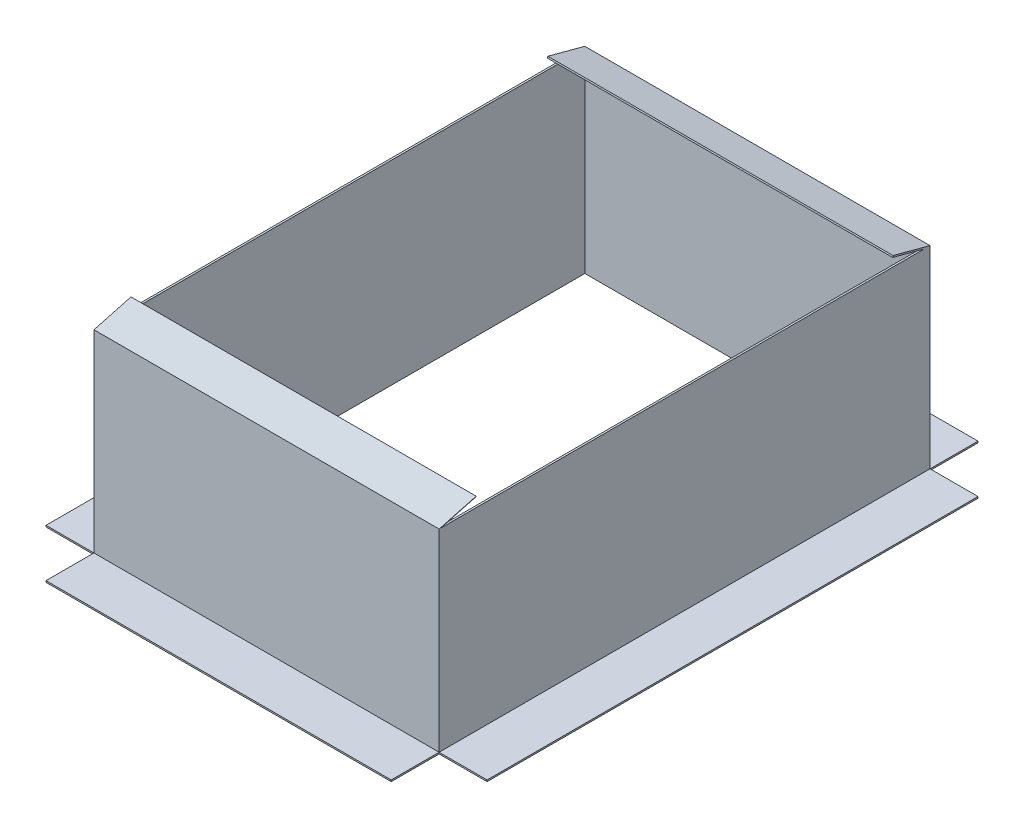
from build123d import *

# Parameters (mm, degrees)
SKETCH1_W         = 180
SKETCH1_H         = 256
SKETCH1_W_2       = 178
SKETCH1_H_2       = 254
EXTRUSION1_DEPTH  = 101.6
SKETCH2_W         = 180
SKETCH2_H         = 25
SKETCH2_W_2       = 25
SKETCH2_H_2       = 256
EXTRUSION3_DEPTH  = 0.8
EXTRUSION10_REACH = 277.239


with BuildPart() as part:
    # Sketch1 → Extrusion1 (new body)
    with BuildSketch(Plane(origin=(0, 0, 0), x_dir=(-1, 0, 0), z_dir=(0, 1, 0))):
        Rectangle(SKETCH1_W, SKETCH1_H)
        Rectangle(SKETCH1_W_2, SKETCH1_H_2, mode=Mode.SUBTRACT)
    extrude(amount=EXTRUSION1_DEPTH)

    # Sketch2 → Extrusion3 (add)
    with BuildSketch(Plane.XZ):
        with Locations((0, 140.5)):
            Rectangle(SKETCH2_W, SKETCH2_H)
        with Locations((0, -140.5)):
            Rectangle(SKETCH2_W, SKETCH2_H)
        with Locations((102.5, 0)):
            Rectangle(SKETCH2_W_2, SKETCH2_H_2)
        with Locations((-102.5, 0)):
            Rectangle(SKETCH2_W_2, SKETCH2_H_2)
    extrude(amount=-EXTRUSION3_DEPTH)

    # Extrusion10: up to this face of the body (flat: up to its plane)
    extrusion10_end = Plane(part.part.faces().sort_by_distance((-90, 0.4, 140.5))[0])
    # Sketch5 → Extrusion10 (add, up to the picked face)
    with BuildSketch(Plane(origin=(90, 0, 0), x_dir=(0, 0, -1), z_dir=(1, 0, 0)), mode=Mode.PRIVATE) as extrusion10_sk1:
        Polygon((-128, 101.6), (-127.2, 101.6), (-108.627893636, 106.576380902), (-108.681483474, 106.776380902), align=None)
    extrusion10_tool1 = split(extrude(extrusion10_sk1.sketch, amount=-EXTRUSION10_REACH, mode=Mode.PRIVATE), bisect_by=extrusion10_end, keep=Keep.BOTH, mode=Mode.PRIVATE)
    # Sketch5 → Extrusion10 (add, up to the picked face)
    with BuildSketch(Plane(origin=(90, 0, 0), x_dir=(0, 0, -1), z_dir=(1, 0, 0)), mode=Mode.PRIVATE) as extrusion10_sk2:
        Polygon((124.909037356, 101.6), (128, 101.6), (108.681483474, 106.776380902), (108.474428238, 106.003640241), align=None)
    extrusion10_tool2 = split(extrude(extrusion10_sk2.sketch, amount=-EXTRUSION10_REACH, mode=Mode.PRIVATE), bisect_by=extrusion10_end, keep=Keep.BOTH, mode=Mode.PRIVATE)
    add(extrusion10_tool1.solids().sort_by(Axis((90, 104.138519, 118.128746), (-1, 0, 0)))[0])
    add(extrusion10_tool2.solids().sort_by(Axis((90, 104.000199, -117.538406), (-1, 0, 0)))[0])


solid = part.part
